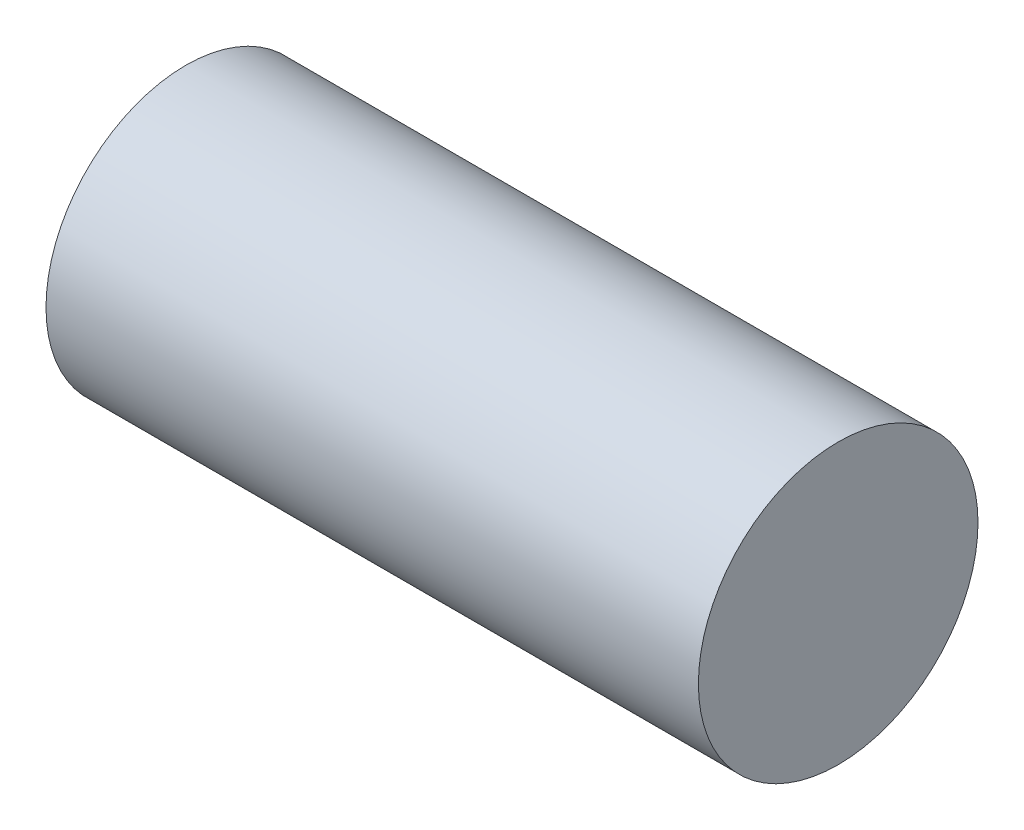
from build123d import *

# Parameters (mm, degrees)
SKETCH1_W = 3.5
SKETCH1_H = 1.5


with BuildPart() as part:
    # Sketch1 → Revolve5 (revolve)
    with BuildSketch(Plane.XY, mode=Mode.PRIVATE) as revolve5_sk:
        with Locations((-1.75, 0.75)):
            Rectangle(SKETCH1_W, SKETCH1_H)
    revolve5 = revolve(revolve5_sk.sketch.rotate(Axis((0, 0, 0), (1, 0, 0)), 90), axis=Axis((0, 0, 0), (1, 0, 0)))

    # Mirror1: Revolve5 across plane
    add(revolve5.mirror(Plane(origin=(0, 0, 0), x_dir=(0, 0, 1), z_dir=(1, 0, 0))))


solid = part.part
